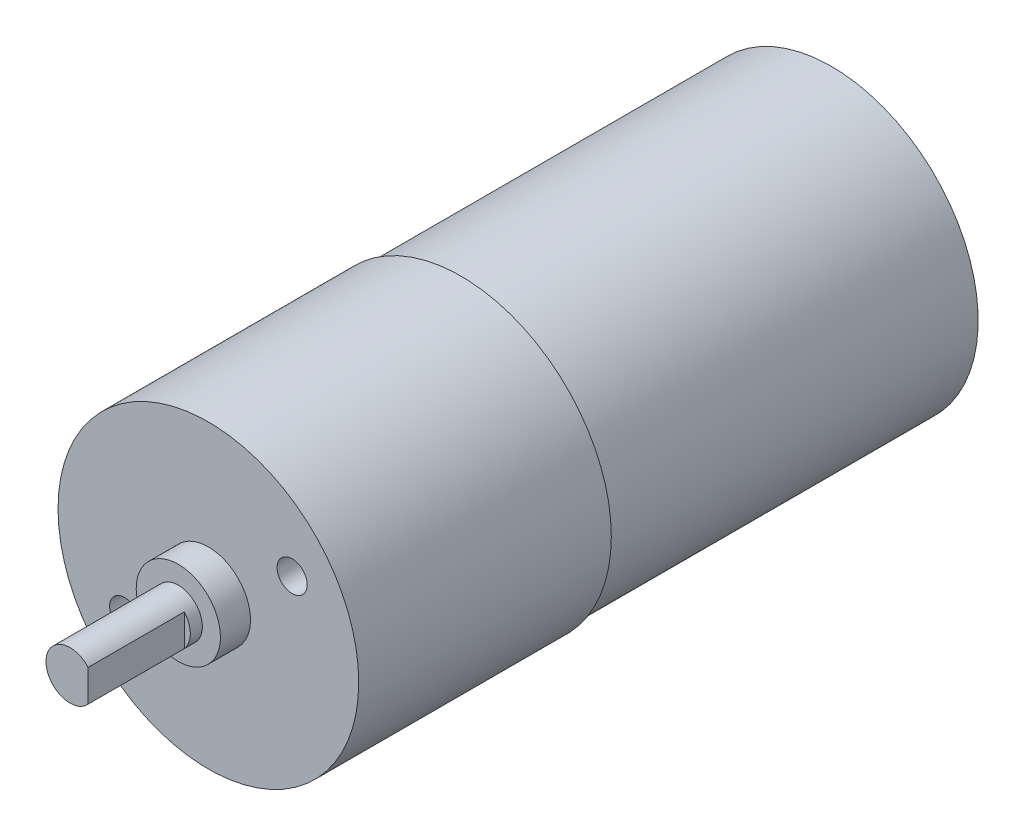
from build123d import *

# Parameters (mm, degrees)
SHAFT_D_FLAT_DEPTH      = 55.733353634
SHAFT_D_FLAT_DEPTH_BACK = 55.733353634
SKETCH2_W               = 1.5
SKETCH2_H               = 8.5
SKETCH3_R               = 1.25
M3_MOUNTING_HOLES_DEPTH = 3.5


with BuildPart() as part:
    # Sketch1 → Motor Body (revolve)
    with BuildSketch(Plane(origin=(0, 0, 0), x_dir=(-1, 0, 0), z_dir=(0, 1, 0))):
        Polygon((0, 11.5), (-2, 11.5), (-2, 2.5), (-3.5, 2.5), (-3.5, 0), (-12.5, 0), (-12.5, -21), (-12.2, -21), (-12.2, -51.8), (0, -51.8), align=None)
    revolve(axis=Axis((0, 0, -60), (0, 0, 1)))

    # Sketch2 → Shaft D-Flat (cut, two sides: drawn at the far end of the back side and taken through both)
    with BuildSketch(Plane(origin=(0, 0, 0), x_dir=(-1, 0, 0), z_dir=(0, 1, 0)).offset(-SHAFT_D_FLAT_DEPTH_BACK)):
        with Locations((-2.25, 7.75)):
            Rectangle(SKETCH2_W, SKETCH2_H)
    extrude(amount=SHAFT_D_FLAT_DEPTH + SHAFT_D_FLAT_DEPTH_BACK, mode=Mode.SUBTRACT)

    # Sketch3 → M3 Mounting Holes (cut)
    with BuildSketch(Plane(origin=(0, 0, 0), x_dir=(0, 1, 0), z_dir=(0, 0, 1))):
        with Locations((4.875399709, -6.962792376)):
            Circle(SKETCH3_R)
        with Locations((-4.875399709, 6.962792376)):
            Circle(SKETCH3_R)
    extrude(amount=-M3_MOUNTING_HOLES_DEPTH, mode=Mode.SUBTRACT)


solid = part.part
